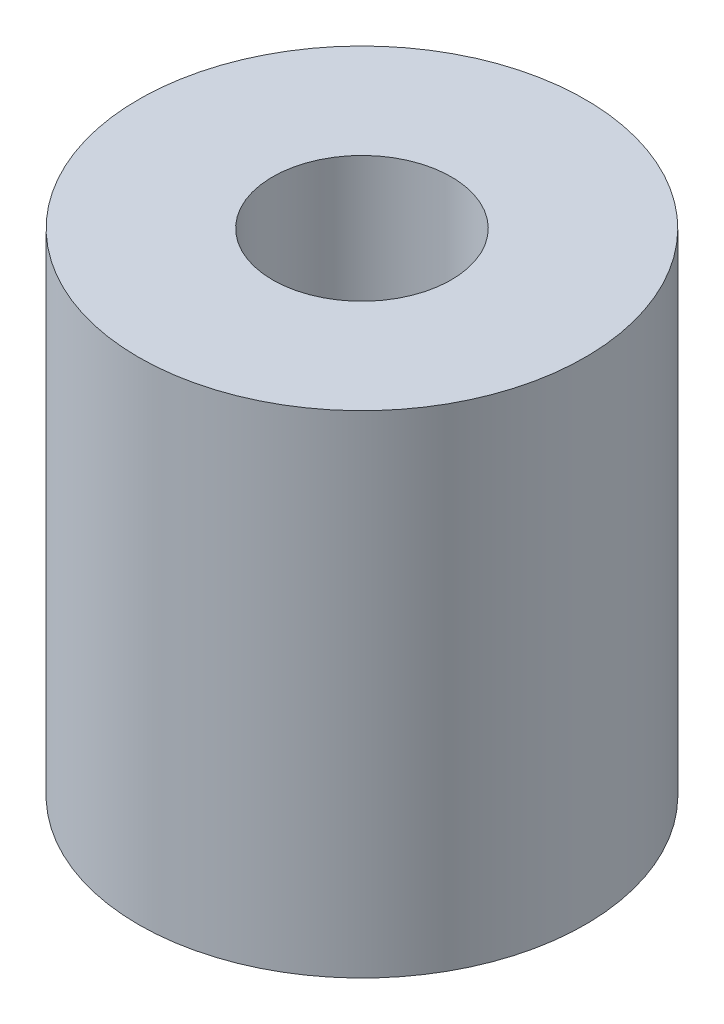
from build123d import *

# Parameters (mm, degrees)
SKETCH1_R           = 2.5
SKETCH1_R_2         = 1
BOSS_EXTRUDE1_DEPTH = 5.5


with BuildPart() as part:
    # Sketch1 → Boss-Extrude1 (new body)
    with BuildSketch(Plane(origin=(0, 0, 0), x_dir=(1, 0, 0), z_dir=(0, 1, 0))):
        with Locations(Location((0, 0, 0), (0, 0, 270))):
            Circle(SKETCH1_R)
        with Locations(Location((0, 0, 0), (0, 0, 270))):
            Circle(SKETCH1_R_2, mode=Mode.SUBTRACT)
    extrude(amount=BOSS_EXTRUDE1_DEPTH)


solid = part.part
